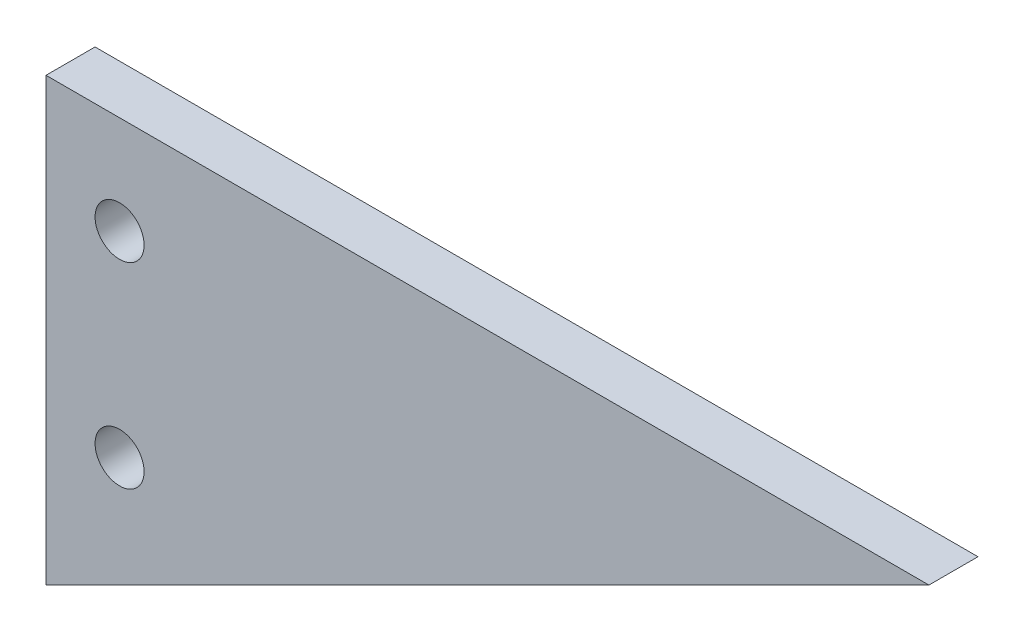
from build123d import *

# Parameters (mm, degrees)
BOSS_EXTRUDE2_DEPTH = 10
SKETCH6_R           = 5
CUT_EXTRUDE2_DEPTH  = 202.494416796


with BuildPart() as part:
    # Sketch5 → Boss-Extrude2 (new body)
    with BuildSketch(Plane.XY):
        Polygon((0, 0), (180, 0), (0, -90), align=None)
    extrude(amount=-BOSS_EXTRUDE2_DEPTH)

    # Sketch6 → Cut-Extrude2 (cut, through all)
    with BuildSketch(Plane.XY):
        with Locations((15, -20)):
            Circle(SKETCH6_R)
        with Locations((15, -60)):
            Circle(SKETCH6_R)
    extrude(amount=-CUT_EXTRUDE2_DEPTH, mode=Mode.SUBTRACT)


solid = part.part
